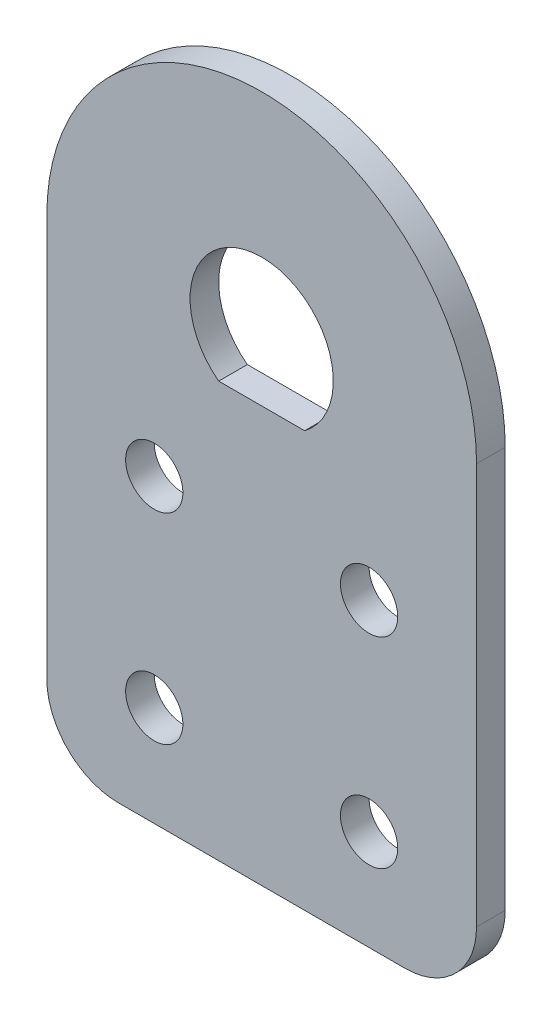
from build123d import *

# Parameters (mm, degrees)
SKETCH_1_R      = 2
EXTRUDE_1_DEPTH = 2
FILLET_1_R      = 5


with BuildPart() as part:
    # 草图1 → 凸台-拉伸1 (new body)
    with BuildSketch(Plane.XY):
        with BuildLine():
            Line((15, 18.803472682), (15, -14.196527318))
            Line((15, -14.196527318), (-15, -14.196527318))
            Line((-15, -14.196527318), (-15, 18.803472682))
            ThreePointArc((-15, 18.803472682), (0, 33.803472682), (15, 18.803472682))
        make_face()
        with Locations((-7.5, 6.803472682)):
            Circle(SKETCH_1_R, mode=Mode.SUBTRACT)
        with Locations((-7.5, -7.196527318)):
            Circle(SKETCH_1_R, mode=Mode.SUBTRACT)
        with Locations(Location((7.5, -7.196527318, 0), (0, 0, 180))):
            Circle(SKETCH_1_R, mode=Mode.SUBTRACT)
        with Locations(Location((7.5, 6.803472682, 0), (0, 0, 180))):
            Circle(SKETCH_1_R, mode=Mode.SUBTRACT)
        with BuildLine():
            Line((-3, 14.803472682), (3, 14.803472682))
            ThreePointArc((3, 14.803472682), (0, 23.803472682), (-3, 14.803472682))
        make_face(mode=Mode.SUBTRACT)
    extrude(amount=EXTRUDE_1_DEPTH)

    # 圆角1
    fillet_1_edges = [part.edges().sort_by_distance(p)[0] for p in [
        (15, -14.196527318, 1),
        (-15, -14.196527318, 1),
    ]]
    fillet(fillet_1_edges, radius=FILLET_1_R)


solid = part.part
